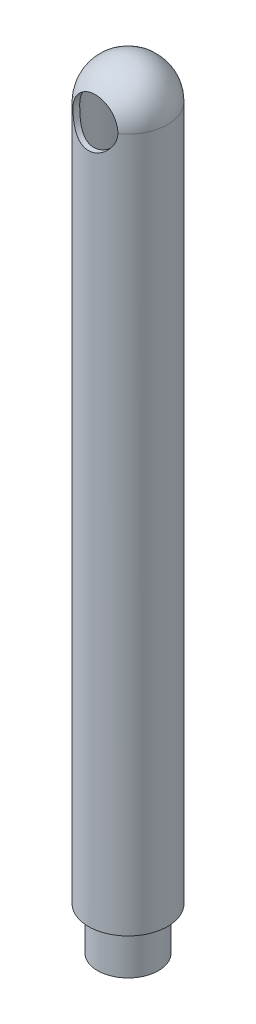
from build123d import *

# Parameters (mm, degrees)
CUT_EXTRUDE1_DEPTH      = 728.883232394
CUT_EXTRUDE1_DEPTH_BACK = 728.883232394
SKETCH2_R               = 21


with BuildPart() as part:
    # Sketch1 → Revolve1 (revolve)
    with BuildSketch(Plane.XY, mode=Mode.PRIVATE) as revolve1_sk:
        with BuildLine():
            Line((23.5, 0), (28.5, 0))
            Line((28.5, 0), (28.5, 40))
            Line((28.5, 40), (37, 40))
            Line((37, 40), (37, 689))
            ThreePointArc((37, 689), (26.162950904, 715.162950904), (0, 726))
            Line((0, 726), (0, 721))
            ThreePointArc((0, 721), (22.627416998, 711.627416998), (32, 689))
            Line((32, 689), (32, 45))
            Line((32, 45), (23.5, 45))
            Line((23.5, 45), (23.5, 0))
        make_face()
    revolve(revolve1_sk.sketch.rotate(Axis((0, 0, 0), (0, 1, 0)), 90), axis=Axis((0, 0, 0), (0, 1, 0)))

    # Sketch2 → Cut-Extrude1 (cut, two sides: drawn at the far end of the back side and taken through both)
    with BuildSketch(Plane.XY.offset(-CUT_EXTRUDE1_DEPTH_BACK)):
        with Locations((0, 689)):
            Circle(SKETCH2_R)
    extrude(amount=CUT_EXTRUDE1_DEPTH + CUT_EXTRUDE1_DEPTH_BACK, mode=Mode.SUBTRACT)


solid = part.part
